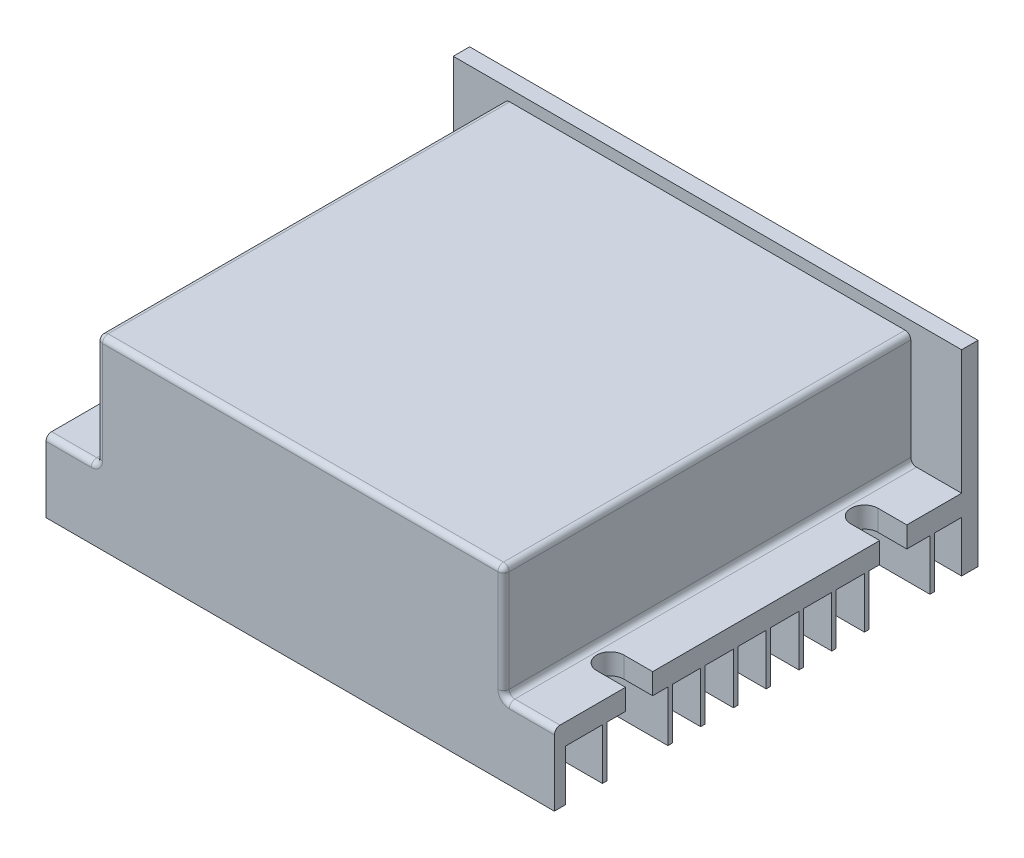
from build123d import *

# Parameters (mm, degrees)
ESQUISSE1_W             = 90
ESQUISSE1_H             = 75
BOSS_EXTRU_1_DEPTH      = 3.7
ESQUISSE2_W             = 90
ESQUISSE2_H             = 2.9
ESQUISSE2_H_2           = 2
ESQUISSE2_H_3           = 0.8
BOSS_EXTRU_2_DEPTH      = 9
ENL_V_MAT_EXTRU_1_DEPTH = 118.84010353
ESQUISSE4_W             = 90
ESQUISSE4_H             = 2.9
BOSS_EXTRU_3_DEPTH      = 22
ESQUISSE5_W             = 72
ESQUISSE5_H             = 72.1
BOSS_EXTRU_4_DEPTH      = 20
CONG_1_R                = 1


with BuildPart() as part:
    # Esquisse1 → Boss.-Extru.1 (new body)
    with BuildSketch(Plane(origin=(0, 0, 0), x_dir=(1, 0, 0), z_dir=(0, 1, 0))):
        with Locations((45, 37.5)):
            Rectangle(ESQUISSE1_W, ESQUISSE1_H)
    extrude(amount=BOSS_EXTRU_1_DEPTH)

    # Esquisse2 → Boss.-Extru.2 (add)
    with BuildSketch(Plane.XZ):
        with Locations((45, -73.55)):
            Rectangle(ESQUISSE2_W, ESQUISSE2_H)
        with Locations((45, -1)):
            Rectangle(ESQUISSE2_W, ESQUISSE2_H_2)
        with Locations((45, -66.9)):
            Rectangle(ESQUISSE2_W, ESQUISSE2_H_3)
        with Locations((45, -61.1)):
            Rectangle(ESQUISSE2_W, ESQUISSE2_H_3)
        with Locations((45, -55.3)):
            Rectangle(ESQUISSE2_W, ESQUISSE2_H_3)
        with Locations((45, -49.5)):
            Rectangle(ESQUISSE2_W, ESQUISSE2_H_3)
        with Locations((45, -43.7)):
            Rectangle(ESQUISSE2_W, ESQUISSE2_H_3)
        with Locations((45, -37.9)):
            Rectangle(ESQUISSE2_W, ESQUISSE2_H_3)
        with Locations((45, -32.1)):
            Rectangle(ESQUISSE2_W, ESQUISSE2_H_3)
        with Locations((45, -26.3)):
            Rectangle(ESQUISSE2_W, ESQUISSE2_H_3)
        with Locations((45, -20.5)):
            Rectangle(ESQUISSE2_W, ESQUISSE2_H_3)
        with Locations((45, -14.7)):
            Rectangle(ESQUISSE2_W, ESQUISSE2_H_3)
        with Locations((45, -8.9)):
            Rectangle(ESQUISSE2_W, ESQUISSE2_H_3)
    extrude(amount=BOSS_EXTRU_2_DEPTH)

    # Esquisse3 → Enlèv. mat.-Extru.1 (cut, through all)
    with BuildSketch(Plane(origin=(0, 3.7, 0), x_dir=(1, 0, 0), z_dir=(0, 1, 0))):
        with BuildLine():
            Line((90, 12.6), (84.9, 12.6))
            ThreePointArc((84.9, 12.6), (82.5, 15), (84.9, 17.4))
            Line((84.9, 17.4), (90, 17.4))
            Line((90, 17.4), (90, 12.6))
        make_face()
        with BuildLine():
            Line((84.9, 57.6), (90, 57.6))
            Line((90, 57.6), (90, 62.4))
            Line((90, 62.4), (84.9, 62.4))
            ThreePointArc((84.9, 62.4), (82.5, 60), (84.9, 57.6))
        make_face()
        with BuildLine():
            Line((0, 57.6), (0, 62.4))
            Line((0, 62.4), (5.1, 62.4))
            ThreePointArc((5.1, 62.4), (7.5, 60), (5.1, 57.6))
            Line((5.1, 57.6), (0, 57.6))
        make_face()
        with BuildLine():
            Line((0, 17.4), (0, 12.6))
            Line((0, 12.6), (5.1, 12.6))
            ThreePointArc((5.1, 12.6), (7.5, 15), (5.1, 17.4))
            Line((5.1, 17.4), (0, 17.4))
        make_face()
    extrude(amount=-ENL_V_MAT_EXTRU_1_DEPTH, mode=Mode.SUBTRACT)

    # Esquisse4 → Boss.-Extru.3 (add)
    with BuildSketch(Plane(origin=(0, 3.7, 0), x_dir=(1, 0, 0), z_dir=(0, 1, 0))):
        with Locations((45, 73.55)):
            Rectangle(ESQUISSE4_W, ESQUISSE4_H)
    extrude(amount=BOSS_EXTRU_3_DEPTH)

    # Esquisse5 → Boss.-Extru.4 (add)
    with BuildSketch(Plane(origin=(0, 3.7, 0), x_dir=(1, 0, 0), z_dir=(0, 1, 0))):
        with Locations((45, 36.05)):
            Rectangle(ESQUISSE5_W, ESQUISSE5_H)
    extrude(amount=BOSS_EXTRU_4_DEPTH)

    # Congé1
    cong_1_edges = [part.edges().sort_by_distance(p)[0] for p in [
        (4.5, 3.7, 0),
        (85.5, 3.7, 0),
        (9, 3.7, -36.05),
        (81, 13.7, 0),
        (81, 3.7, -36.05),
        (81, 23.7, -36.05),
        (9, 13.7, 0),
        (45, 23.7, 0),
        (9, 23.7, -36.05),
    ]]
    fillet(cong_1_edges, radius=CONG_1_R)


solid = part.part
